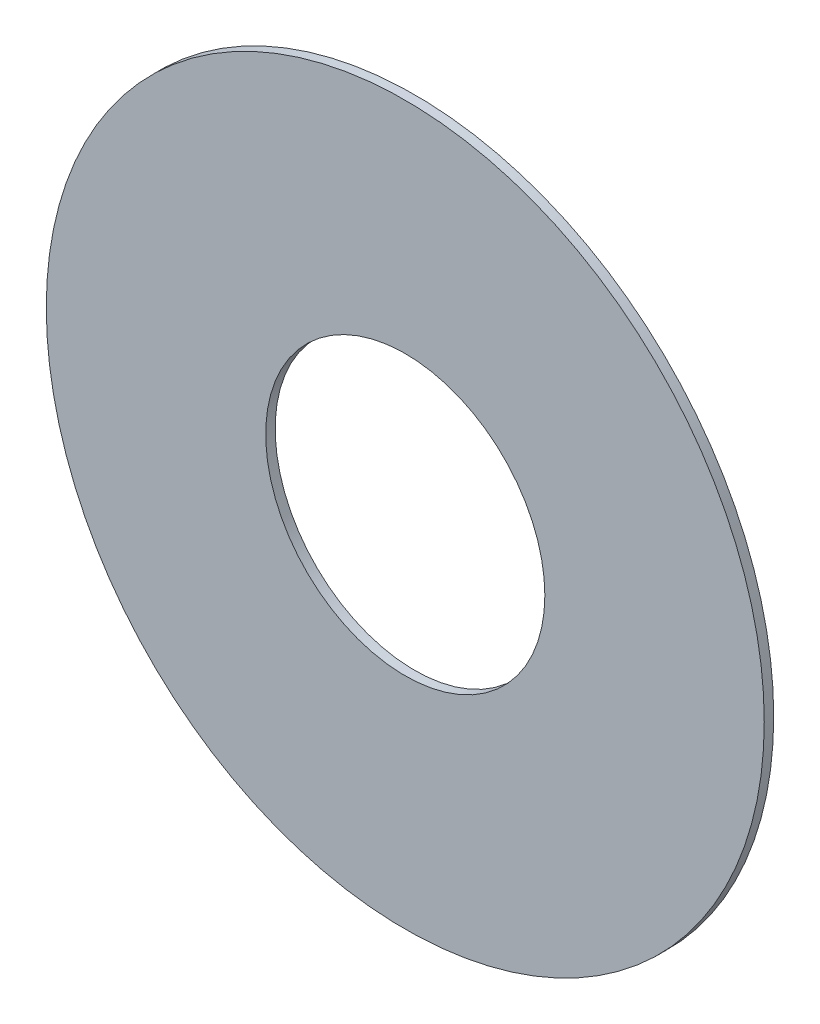
from build123d import *

# Parameters (mm, degrees)
PRINTED_GUARD_START = -42.5
SKETCH_1_R          = 75.876923077
SKETCH_1_R_2        = 29.5
PRINTED_GUARD_DEPTH = 2


with BuildPart() as part:
    # Эскиз1 → Printed_guard (new body)
    with BuildSketch(Plane.XY.offset(PRINTED_GUARD_START)):
        Circle(SKETCH_1_R)
        Circle(SKETCH_1_R_2, mode=Mode.SUBTRACT)
    extrude(amount=PRINTED_GUARD_DEPTH)


solid = part.part
